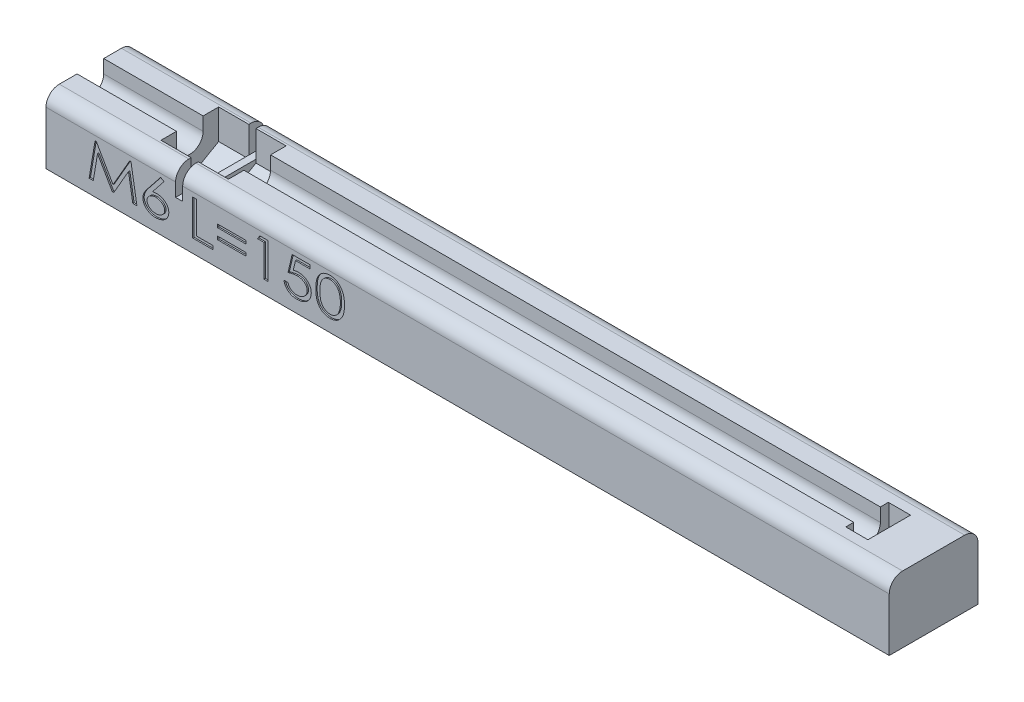
from build123d import *

# Parameters (mm, degrees)
SKETCH1_W                      = 180
SKETCH1_H                      = 20
BOSS_EXTRUDE1_DEPTH            = 15
CUT_EXTRUDE1_REACH             = 93.788
CUT_EXTRUDE1_DIRECTION_2_REACH = 93.788
BOSS_EXTRUDE2_DEPTH            = 10
CUT_EXTRUDE2_DEPTH             = 5
SKETCH8_W                      = 6.461538462
SKETCH8_H                      = 0.717948717
CUT_EXTRUDE3_DEPTH             = 0.3
CUT_EXTRUDE4_DEPTH             = 6.8
SKETCH10_W                     = 1.6
SKETCH10_H                     = 20
CUT_EXTRUDE5_DEPTH             = 6
FILLET1_R                      = 3


with BuildPart() as part:
    # Sketch1 → Boss-Extrude1 (new body)
    with BuildSketch(Plane(origin=(0, 0, 0), x_dir=(1, 0, 0), z_dir=(0, 1, 0))):
        Rectangle(SKETCH1_W, SKETCH1_H)
    extrude(amount=BOSS_EXTRUDE1_DEPTH)

    # Sketch2 → Cut-Extrude1 (cut, up to next)
    with BuildSketch(Plane(origin=(0, 0, 0), x_dir=(0, 0, -1), z_dir=(1, 0, 0)), mode=Mode.PRIVATE) as cut_extrude1_sk1:
        with BuildLine():
            Line((-3, 15), (-3, 12))
            ThreePointArc((-3, 12), (0, 9), (3, 12))
            Line((3, 12), (3, 15))
            Line((3, 15), (-3, 15))
        make_face()
    cut_extrude1_tool1 = extrude(cut_extrude1_sk1.sketch, amount=-CUT_EXTRUDE1_REACH, mode=Mode.PRIVATE) & part.part
    add(cut_extrude1_tool1.solids().sort_by_distance((0, 12.28005, 0))[0], mode=Mode.SUBTRACT)

    # Sketch2 → Cut-Extrude1 direction 2 (cut, up to next)
    with BuildSketch(Plane(origin=(0, 0, 0), x_dir=(0, 0, -1), z_dir=(1, 0, 0)), mode=Mode.PRIVATE) as cut_extrude1_direction_2_sk1:
        with BuildLine():
            Line((-3, 15), (-3, 12))
            ThreePointArc((-3, 12), (0, 9), (3, 12))
            Line((3, 12), (3, 15))
            Line((3, 15), (-3, 15))
        make_face()
    cut_extrude1_direction_2_tool1 = extrude(cut_extrude1_direction_2_sk1.sketch, amount=CUT_EXTRUDE1_DIRECTION_2_REACH, mode=Mode.PRIVATE) & part.part
    add(cut_extrude1_direction_2_tool1.solids().sort_by_distance((0, 12.28005, 0))[0], mode=Mode.SUBTRACT)

    # Sketch4 → Boss-Extrude2 (add)
    with BuildSketch(Plane(origin=(90, 0, 0), x_dir=(0, 0, -1), z_dir=(1, 0, 0))):
        Polygon((-3, 15), (3, 15), (10, 15), (10, 0), (-10, 0), (-10, 15), align=None)
    extrude(amount=BOSS_EXTRUDE2_DEPTH)

    # Sketch5 → Cut-Extrude2 (cut)
    with BuildSketch(Plane.ZY.offset(-90)):
        Polygon((0, 6.226497308), (5, 9.113248654), (5, 14.886751346), (0, 17.773502692), (-5, 14.886751346), (-5, 9.113248654), align=None)
    extrude(amount=CUT_EXTRUDE2_DEPTH, mode=Mode.SUBTRACT)

    # Sketch8 → Cut-Extrude3 (cut)
    # profile 1 of 8: a face of its own
    with BuildSketch(Plane.XY.offset(10)):
        Polygon((-80.282051282, 3), (-78.9375, 11), (-78.679487179, 11), (-74.897435897, 4.435897436), (-71.120192308, 11), (-70.858974359, 11), (-69.512820513, 3), (-70.443910256, 3), (-71.41025641, 8.743589744), (-74.71474359, 3), (-75.076923077, 3), (-78.384615385, 8.743589744), (-79.349358974, 3), align=None)
    # profile 2 of 8: a face of its own
    with BuildSketch(Plane.XY.offset(10)):
        with BuildLine():
            Line((-64.179487179, 11.205128205), (-63.411858974, 10.770833333))
            Line((-63.411858974, 10.770833333), (-65.996794872, 7.52724359))
            add(Edge.make_bspline(
                [(-65.996794872, 7.52724359), (-65.912495608, 7.540827068), (-65.747518127, 7.567410552), (-65.502521291, 7.59368184), (-65.265811478, 7.613319824), (-65.110082042, 7.614704869), (-65.033653846, 7.615384615)],
                knots=[0, 0, 0, 0, 1.058010251, 2.070574033, 3.053084957, 4, 4, 4, 4], degree=3))
            add(Edge.make_bspline(
                [(-65.033653846, 7.615384615), (-64.941142185, 7.613199815), (-64.759293256, 7.608905181), (-64.492341335, 7.57594411), (-64.23579274, 7.523560159), (-63.990526204, 7.448361123), (-63.756147485, 7.350603389), (-63.53113423, 7.234836131), (-63.318894141, 7.093224853), (-63.118233537, 6.934764045), (-62.935335607, 6.759779983), (-62.773686184, 6.573842937), (-62.638207487, 6.376807243), (-62.526454029, 6.170183519), (-62.439254094, 5.953081813), (-62.378871287, 5.725366823), (-62.340727108, 5.488460328), (-62.335821859, 5.327069117), (-62.333333333, 5.245192308)],
                knots=[0, 0, 0, 0, 1.109968203, 2.181849582, 3.222882052, 4.248963466, 5.254961958, 6.267151018, 7.280638538, 8.311873863, 9.332070617, 10.313900366, 11.263471539, 12.195680032, 13.127800347, 14.063968214, 15.01781452, 16, 16, 16, 16], degree=3))
            add(Edge.make_bspline(
                [(-62.333333333, 5.245192308), (-62.334634421, 5.188519095), (-62.337206059, 5.076502866), (-62.355622422, 4.910535031), (-62.383754533, 4.748534083), (-62.425547858, 4.59087795), (-62.4807846, 4.438029287), (-62.54674878, 4.288702959), (-62.623215906, 4.142306462), (-62.713399645, 4.002218594), (-62.812654438, 3.866578149), (-62.923925202, 3.738880816), (-63.043126834, 3.616489003), (-63.175109332, 3.504601305), (-63.313788371, 3.396042317), (-63.465362986, 3.297602588), (-63.625361925, 3.204141571), (-63.85234163, 3.09130817), (-64.149380301, 2.972902), (-64.521411744, 2.869005382), (-64.907111294, 2.807110703), (-65.169116617, 2.7989755), (-65.301282051, 2.794871795)],
                knots=[0, 0, 0, 0, 0.793694434, 1.568759805, 2.336385538, 3.095024302, 3.850001251, 4.610482715, 5.380293346, 6.160757427, 6.941938517, 7.732416952, 8.53134919, 9.332380938, 10.154010605, 10.996565294, 11.861546569, 12.748292787, 14.544837905, 16.331163668, 18.149299636, 20, 20, 20, 20], degree=3))
            add(Edge.make_bspline(
                [(-65.301282051, 2.794871795), (-65.429186955, 2.798336228), (-65.681605941, 2.805173252), (-66.053155279, 2.866565024), (-66.410324504, 2.966290001), (-66.695667858, 3.080419274), (-66.911828219, 3.191819881), (-67.065914215, 3.28337294), (-67.211822968, 3.381826097), (-67.347087535, 3.490452864), (-67.474010158, 3.60599811), (-67.592838812, 3.72923723), (-67.702114521, 3.861012843), (-67.801234806, 4.000590153), (-67.8902917, 4.145031058), (-67.967808684, 4.292695748), (-68.031664141, 4.443235271), (-68.087149488, 4.595168754), (-68.128647296, 4.750737452), (-68.157262773, 4.908892787), (-68.175473172, 5.069021774), (-68.178147073, 5.176768646), (-68.179487179, 5.230769231)],
                knots=[0, 0, 0, 0, 1.828951268, 3.609416145, 5.37106455, 7.126684359, 7.994917793, 8.848221521, 9.689807274, 10.511017729, 11.32794916, 12.14416524, 12.958339119, 13.774841414, 14.59148678, 15.384581438, 16.158327137, 16.929501742, 17.697031907, 18.458564307, 19.227463161, 20, 20, 20, 20], degree=3))
            add(Edge.make_bspline(
                [(-68.179487179, 5.230769231), (-68.176705795, 5.313228318), (-68.171013502, 5.481986509), (-68.123242199, 5.737022466), (-68.049075253, 5.998371198), (-67.962734452, 6.218615133), (-67.87554778, 6.39984197), (-67.799556311, 6.545603759), (-67.708253783, 6.696265827), (-67.607296752, 6.854972959), (-67.495814272, 7.021154707), (-67.371271231, 7.193364057), (-67.23552641, 7.372351301), (-67.139167047, 7.492739267), (-67.08974359, 7.554487179)],
                knots=[0, 0, 0, 0, 1.13348608, 2.31975718, 3.55715173, 4.86705391, 5.567099386, 6.323062346, 7.127029747, 7.989257616, 8.910398579, 9.879022036, 10.912134108, 12, 12, 12, 12], degree=3))
            Line((-67.08974359, 7.554487179), (-64.179487179, 11.205128205))
        make_face()
        with BuildLine():
            add(Edge.make_bspline(
                [(-65.253205128, 6.794871795), (-65.321085529, 6.793067507), (-65.454492267, 6.789521503), (-65.65092259, 6.769446701), (-65.839091848, 6.731250723), (-66.020988419, 6.682906493), (-66.194488387, 6.616431545), (-66.360533454, 6.535727659), (-66.519564326, 6.441274587), (-66.668620819, 6.332806559), (-66.806525491, 6.215525531), (-66.926462418, 6.088997544), (-67.029066489, 5.956991264), (-67.1113176, 5.81780367), (-67.1759844, 5.67263633), (-67.222743422, 5.521583525), (-67.250771838, 5.363749432), (-67.254507833, 5.256523887), (-67.256410256, 5.201923077)],
                knots=[0, 0, 0, 0, 1.148408277, 2.256990234, 3.334386658, 4.393132075, 5.43692792, 6.471453079, 7.512782197, 8.561065829, 9.586196649, 10.570453501, 11.504795903, 12.408218857, 13.298120773, 14.186967025, 15.076777194, 16, 16, 16, 16], degree=3))
            add(Edge.make_bspline(
                [(-67.256410256, 5.201923077), (-67.254569622, 5.147837068), (-67.250955381, 5.041634632), (-67.221981849, 4.885299639), (-67.178352863, 4.734533097), (-67.112604026, 4.590075834), (-67.029277973, 4.452738571), (-66.927708301, 4.321111979), (-66.809715921, 4.194236207), (-66.6717909, 4.077458608), (-66.52300085, 3.969489682), (-66.364709621, 3.873787454), (-66.198399933, 3.793687617), (-66.024016088, 3.730162352), (-65.843292628, 3.677855313), (-65.65455776, 3.641224821), (-65.457721652, 3.620639882), (-65.324298838, 3.617156858), (-65.256410256, 3.615384615)],
                knots=[0, 0, 0, 0, 0.916677999, 1.799974513, 2.688598419, 3.572638058, 4.483161525, 5.407330741, 6.388036378, 7.415942545, 8.467064206, 9.503440141, 10.548924041, 11.592364598, 12.647694815, 13.736899392, 14.848482625, 16, 16, 16, 16], degree=3))
            add(Edge.make_bspline(
                [(-65.256410256, 3.615384615), (-65.188524834, 3.617171967), (-65.055108228, 3.620684687), (-64.858749282, 3.641000239), (-64.670178714, 3.678345762), (-64.489275729, 3.729888733), (-64.314766886, 3.793321891), (-64.149404059, 3.874242193), (-63.991386269, 3.969427555), (-63.842671657, 4.077498144), (-63.704590181, 4.194143597), (-63.586891765, 4.321660593), (-63.483362823, 4.452188809), (-63.400306249, 4.590145254), (-63.334443767, 4.734514627), (-63.290844996, 4.885304536), (-63.261863483, 5.041633356), (-63.258250334, 5.147836638), (-63.256410256, 5.201923077)],
                knots=[0, 0, 0, 0, 1.151718944, 2.263496754, 3.34399913, 4.408229967, 5.451853174, 6.489360693, 7.52591804, 8.577223696, 9.605309794, 10.586187099, 11.516053716, 12.426736566, 13.310930953, 14.199710409, 15.083161541, 16, 16, 16, 16], degree=3))
            add(Edge.make_bspline(
                [(-63.256410256, 5.201923077), (-63.258269036, 5.256536183), (-63.261919324, 5.363785875), (-63.2905447, 5.521290976), (-63.334882218, 5.672863865), (-63.399676039, 5.818309237), (-63.484109044, 5.9560363), (-63.584515547, 6.089059783), (-63.703192268, 6.215955329), (-63.841007777, 6.332813434), (-63.989815083, 6.440772255), (-64.147738, 6.536182805), (-64.313557194, 6.616395333), (-64.486567434, 6.68260805), (-64.667781509, 6.731512764), (-64.855499359, 6.769402367), (-65.051914907, 6.789533189), (-65.185323688, 6.793071448), (-65.253205128, 6.794871795)],
                knots=[0, 0, 0, 0, 0.924732328, 1.815997387, 2.703671035, 3.595027991, 4.504577782, 5.434961697, 6.414618607, 7.441425573, 8.491423209, 9.526690886, 10.562907551, 11.608410062, 12.66016143, 13.739319459, 14.84971401, 16, 16, 16, 16], degree=3))
        make_face(mode=Mode.SUBTRACT)
    # profile 3 of 8: a face of its own
    with BuildSketch(Plane.XY.offset(10)):
        Polygon((-57, 11), (-56.076923077, 11), (-56.076923077, 3.820512821), (-52.384615385, 3.820512821), (-52.384615385, 3), (-57, 3), align=None)
    # profile 4 of 8: a face of its own
    with BuildSketch(Plane.XY.offset(10)):
        with Locations((-48.128205128, 8.17948718)):
            Rectangle(SKETCH8_W, SKETCH8_H)
    # profile 5 of 8: a face of its own
    with BuildSketch(Plane.XY.offset(10)):
        with Locations((-48.128205128, 5.820512821)):
            Rectangle(SKETCH8_W, SKETCH8_H)
    # profile 6 of 8: a face of its own
    with BuildSketch(Plane.XY.offset(10)):
        Polygon((-41.786858974, 11), (-39.974358974, 11), (-39.974358974, 3), (-40.897435897, 3), (-40.897435897, 10.179487179), (-42.333333333, 10.179487179), align=None)
    # profile 7 of 8: a face of its own
    with BuildSketch(Plane.XY.offset(10)):
        with BuildLine():
            Line((-30.538461538, 11), (-30.538461538, 10.179487179))
            Line((-30.538461538, 10.179487179), (-33.78525641, 10.179487179))
            Line((-33.78525641, 10.179487179), (-34.274038462, 8.065705128))
            add(Edge.make_bspline(
                [(-34.274038462, 8.065705128), (-34.174959039, 8.091031553), (-33.983262053, 8.140032638), (-33.699917774, 8.190258816), (-33.431983812, 8.225582666), (-33.257583508, 8.229076349), (-33.173076923, 8.230769231)],
                knots=[0, 0, 0, 0, 1.098923107, 2.126175579, 3.092028514, 4, 4, 4, 4], degree=3))
            add(Edge.make_bspline(
                [(-33.173076923, 8.230769231), (-33.068802129, 8.228842174), (-32.86390565, 8.225055571), (-32.563806018, 8.188540766), (-32.277396884, 8.131515128), (-32.00543736, 8.051117826), (-31.747248387, 7.948831795), (-31.504306999, 7.820731077), (-31.273673146, 7.671813883), (-31.060473667, 7.498802633), (-30.865958024, 7.310172471), (-30.695381701, 7.106576697), (-30.552795205, 6.889405352), (-30.434067586, 6.659885734), (-30.342888265, 6.416606129), (-30.276834606, 6.160487301), (-30.237882912, 5.891157499), (-30.23317, 5.707392437), (-30.230769231, 5.613782051)],
                knots=[0, 0, 0, 0, 1.134454317, 2.229164743, 3.28500468, 4.309666315, 5.311560225, 6.302360275, 7.294115116, 8.294726146, 9.285577369, 10.239157013, 11.179259903, 12.107548962, 13.045924382, 14.000584569, 14.981492743, 16, 16, 16, 16], degree=3))
            add(Edge.make_bspline(
                [(-30.230769231, 5.613782051), (-30.231851162, 5.548552643), (-30.234002939, 5.418822422), (-30.255853986, 5.226604134), (-30.289558543, 5.038179553), (-30.335486332, 4.853567513), (-30.396965751, 4.673852264), (-30.471197006, 4.49837334), (-30.557841532, 4.326150371), (-30.658154413, 4.159112177), (-30.770451527, 3.999745504), (-30.890494427, 3.84749389), (-31.022543726, 3.707394962), (-31.16216059, 3.574361022), (-31.313190345, 3.453582062), (-31.472465218, 3.340008915), (-31.642353037, 3.238297779), (-31.820590866, 3.145346835), (-32.006154058, 3.061136017), (-32.201256871, 2.991509849), (-32.402244436, 2.93055985), (-32.610846612, 2.88035979), (-32.826054795, 2.842371252), (-33.048646005, 2.815716306), (-33.277980505, 2.796627668), (-33.43371975, 2.795463223), (-33.512820513, 2.794871795)],
                knots=[0, 0, 0, 0, 0.969983009, 1.929131535, 2.873718773, 3.81616439, 4.755993309, 5.696124526, 6.648534221, 7.621572097, 8.591555105, 9.547141935, 10.502960018, 11.452979889, 12.413542823, 13.377026655, 14.360970691, 15.356177306, 16.366340802, 17.389454646, 18.435245734, 19.489516103, 20.579101985, 21.683995992, 22.823689667, 24, 24, 24, 24], degree=3))
            add(Edge.make_bspline(
                [(-33.512820513, 2.794871795), (-33.606404267, 2.796447281), (-33.790348059, 2.799543981), (-34.060094372, 2.831989653), (-34.319416401, 2.878424987), (-34.566874305, 2.948205714), (-34.804275964, 3.036243197), (-35.02955175, 3.145623673), (-35.24491282, 3.272488065), (-35.445645371, 3.420235103), (-35.632371149, 3.58199937), (-35.79970908, 3.757923065), (-35.948827293, 3.944086592), (-36.074739251, 4.14385657), (-36.183736651, 4.353593896), (-36.271146634, 4.57558467), (-36.34177411, 4.80851985), (-36.370220658, 4.969713624), (-36.384615385, 5.051282051)],
                knots=[0, 0, 0, 0, 1.123367549, 2.208038014, 3.258707693, 4.284481523, 5.291404347, 6.295687251, 7.288117666, 8.289013781, 9.284818446, 10.25134312, 11.201179919, 12.144429081, 13.082690711, 14.035750275, 15.006036297, 16, 16, 16, 16], degree=3))
            Line((-36.384615385, 5.051282051), (-35.461538462, 5.051282051))
            add(Edge.make_bspline(
                [(-35.461538462, 5.051282051), (-35.441304775, 4.974906077), (-35.402284032, 4.827614715), (-35.318119136, 4.621004556), (-35.213697738, 4.437591203), (-35.090408308, 4.274196286), (-34.944728592, 4.130689398), (-34.776543085, 4.005531303), (-34.589653711, 3.889348211), (-34.38087329, 3.79483882), (-34.160291996, 3.71340594), (-33.930345231, 3.659240293), (-33.696247729, 3.621042302), (-33.538084544, 3.617281127), (-33.458333333, 3.615384615)],
                knots=[0, 0, 0, 0, 1.062738926, 2.049496155, 2.99307837, 3.896205757, 4.796150332, 5.735228812, 6.713144046, 7.752194435, 8.814349412, 9.87292067, 10.92745488, 12, 12, 12, 12], degree=3))
            add(Edge.make_bspline(
                [(-33.458333333, 3.615384615), (-33.380788243, 3.617272304), (-33.227886555, 3.620994408), (-33.002832151, 3.64927985), (-32.785703358, 3.692876404), (-32.578425451, 3.758720237), (-32.377501894, 3.837580517), (-32.187540795, 3.94044454), (-32.003237118, 4.056683438), (-31.832013041, 4.192734337), (-31.673968369, 4.340742933), (-31.532967348, 4.498422618), (-31.418025356, 4.669063788), (-31.319582585, 4.845511813), (-31.247116965, 5.033201728), (-31.190565404, 5.227936664), (-31.161045095, 5.433398243), (-31.156274799, 5.573104001), (-31.153846154, 5.644230769)],
                knots=[0, 0, 0, 0, 1.088829166, 2.146929194, 3.181356287, 4.194671525, 5.197797381, 6.208024805, 7.223670527, 8.254827386, 9.273931223, 10.262757869, 11.217966775, 12.158058171, 13.094309505, 14.037300533, 15.000753635, 16, 16, 16, 16], degree=3))
            add(Edge.make_bspline(
                [(-31.153846154, 5.644230769), (-31.155608252, 5.708446994), (-31.159062967, 5.83434735), (-31.188719931, 6.01822142), (-31.236602078, 6.192573386), (-31.304695834, 6.357665418), (-31.391772842, 6.513267023), (-31.49650029, 6.661019266), (-31.622788618, 6.797309888), (-31.767192307, 6.923411815), (-31.926333609, 7.038028447), (-32.099270562, 7.138930111), (-32.286646766, 7.220878506), (-32.485102672, 7.293000458), (-32.69768858, 7.344170127), (-32.921851562, 7.383465773), (-33.159285966, 7.405418923), (-33.322073357, 7.408617953), (-33.405448718, 7.41025641)],
                knots=[0, 0, 0, 0, 0.959581286, 1.881325554, 2.776530137, 3.65751396, 4.544163099, 5.437298997, 6.358662586, 7.315081268, 8.299208911, 9.286862571, 10.302126627, 11.352955398, 12.439623036, 13.566177345, 14.753460948, 16, 16, 16, 16], degree=3))
            add(Edge.make_bspline(
                [(-33.405448718, 7.41025641), (-33.478137178, 7.408953064), (-33.627490898, 7.406275066), (-33.856931104, 7.385878224), (-34.097537612, 7.353749703), (-34.349296263, 7.30844776), (-34.611795282, 7.250793813), (-34.885223929, 7.179361612), (-35.17024333, 7.096514599), (-35.362910873, 7.032678206), (-35.461538462, 7)],
                knots=[0, 0, 0, 0, 0.828490731, 1.702308341, 2.623773087, 3.594863751, 4.617271015, 5.686547465, 6.815730754, 8, 8, 8, 8], degree=3))
            Line((-35.461538462, 7), (-34.538461538, 11))
            Line((-34.538461538, 11), (-30.538461538, 11))
        make_face()
    # profile 8 of 8: a face of its own
    with BuildSketch(Plane.XY.offset(10)):
        with BuildLine():
            add(Edge.make_bspline(
                [(-29.205128205, 6.996794872), (-29.204040362, 7.125032019), (-29.201926833, 7.374179129), (-29.181519492, 7.737043877), (-29.15319279, 8.077942489), (-29.107335019, 8.395907618), (-29.052416938, 8.691516012), (-28.98371319, 8.964605331), (-28.902599037, 9.215545651), (-28.807228109, 9.44497791), (-28.700026463, 9.656085774), (-28.585523542, 9.854153325), (-28.45749571, 10.037681568), (-28.32056748, 10.209144418), (-28.172067295, 10.366544944), (-28.015232421, 10.512124573), (-27.845393033, 10.641341739), (-27.668472853, 10.760501145), (-27.481808652, 10.864085633), (-27.289905106, 10.955726055), (-27.092264529, 11.032897367), (-26.889108749, 11.095324747), (-26.681000502, 11.145344701), (-26.467302735, 11.18029996), (-26.248315294, 11.201925593), (-26.100477987, 11.204051863), (-26.025641026, 11.205128205)],
                knots=[0, 0, 0, 0, 1.542683654, 2.997221792, 4.371598944, 5.656797318, 6.860561199, 7.987553175, 9.042377021, 10.030645594, 10.973394823, 11.889388256, 12.780791065, 13.663064894, 14.526958713, 15.382106205, 16.234399085, 17.091789701, 17.946381534, 18.800199673, 19.648776936, 20.49647757, 21.355408439, 22.221808829, 23.099858982, 24, 24, 24, 24], degree=3))
            add(Edge.make_bspline(
                [(-26.025641026, 11.205128205), (-25.949736393, 11.204051384), (-25.799768079, 11.201923858), (-25.577583675, 11.180297788), (-25.360686877, 11.145349459), (-25.149386139, 11.095315897), (-24.943007354, 11.032945055), (-24.742261649, 10.955616928), (-24.546560657, 10.864490029), (-24.357836769, 10.758432782), (-24.175315732, 10.639839535), (-24.00303033, 10.505443872), (-23.840729645, 10.357053574), (-23.686999039, 10.196222565), (-23.545309465, 10.01944407), (-23.411488226, 9.829757832), (-23.288214191, 9.625530826), (-23.174012764, 9.40698213), (-23.070402491, 9.172086281), (-22.98268381, 8.91790429), (-22.90955111, 8.64456707), (-22.849062263, 8.352374713), (-22.800628266, 8.040619786), (-22.768444022, 7.709403577), (-22.746517671, 7.359270119), (-22.744582475, 7.119694237), (-22.743589744, 6.996794872)],
                knots=[0, 0, 0, 0, 0.905226779, 1.788498657, 2.660108446, 3.524138063, 4.376813936, 5.230061085, 6.088148717, 6.949707488, 7.810441066, 8.682307051, 9.552891307, 10.431831136, 11.333484681, 12.252799274, 13.19921049, 14.17683564, 15.192654415, 16.258736151, 17.380986388, 18.565756088, 19.816677794, 21.14251623, 22.534147352, 24, 24, 24, 24], degree=3))
            add(Edge.make_bspline(
                [(-22.743589744, 6.996794872), (-22.744593265, 6.874430905), (-22.746549282, 6.635924888), (-22.768319612, 6.287373526), (-22.801037581, 5.957904186), (-22.847566628, 5.647704116), (-22.905785905, 5.356767374), (-22.980293561, 5.0851961), (-23.065116729, 4.831537216), (-23.167670421, 4.597873914), (-23.280199904, 4.380905615), (-23.402195251, 4.177600104), (-23.535623793, 3.988489618), (-23.677994683, 3.811846391), (-23.83056974, 3.648796172), (-23.995006991, 3.501507931), (-24.167954114, 3.366281031), (-24.350908731, 3.245986412), (-24.541945854, 3.141254895), (-24.73732496, 3.046621285), (-24.940216365, 2.970896244), (-25.146985139, 2.906019688), (-25.35911215, 2.856241064), (-25.576596785, 2.821694182), (-25.799139507, 2.79760738), (-25.949721333, 2.795788719), (-26.025641026, 2.794871795)],
                knots=[0, 0, 0, 0, 1.46072825, 2.847181955, 4.167808125, 5.412532487, 6.590778144, 7.707832089, 8.77274499, 9.781035283, 10.750894225, 11.68935627, 12.609456302, 13.511880197, 14.396205746, 15.272259263, 16.144870147, 17.015170588, 17.883037273, 18.744577062, 19.604510117, 20.465884645, 21.330652466, 22.203006937, 23.093999819, 24, 24, 24, 24], degree=3))
            add(Edge.make_bspline(
                [(-26.025641026, 2.794871795), (-26.100476904, 2.795954073), (-26.248312071, 2.798092069), (-26.467315188, 2.819631789), (-26.680320355, 2.854802014), (-26.887878033, 2.90340072), (-27.090575188, 2.963123532), (-27.286284357, 3.041522522), (-27.477044626, 3.130940879), (-27.662002859, 3.233145963), (-27.838097135, 3.350933815), (-28.007014922, 3.480060816), (-28.164771623, 3.624824647), (-28.309679349, 3.784970176), (-28.449160635, 3.95438779), (-28.575538588, 4.140057874), (-28.692148806, 4.338981515), (-28.800814071, 4.551805187), (-28.897683448, 4.78283054), (-28.981049695, 5.035087933), (-29.048349266, 5.309844878), (-29.106370191, 5.604934923), (-29.150891066, 5.922185567), (-29.182189737, 6.261235348), (-29.201715238, 6.622099518), (-29.203969927, 6.869632423), (-29.205128205, 6.996794872)],
                knots=[0, 0, 0, 0, 0.901313614, 1.780507586, 2.648036619, 3.500347198, 4.347271604, 5.190962528, 6.037324413, 6.884273269, 7.733858471, 8.587261616, 9.443523092, 10.308877354, 11.187293768, 12.085154678, 13.011148997, 13.963773228, 14.961747202, 16.026069565, 17.160769593, 18.367320705, 19.647821669, 21.018168876, 22.468175576, 24, 24, 24, 24], degree=3))
        make_face()
        with BuildLine():
            add(Edge.make_bspline(
                [(-28.282051282, 7), (-28.281020722, 6.893152289), (-28.279020667, 6.685788144), (-28.26670799, 6.384277715), (-28.244153581, 6.1031703), (-28.214612181, 5.842061607), (-28.174160783, 5.601551286), (-28.12737348, 5.380154039), (-28.069628308, 5.179483843), (-28.00360379, 4.997214159), (-27.927416206, 4.831151444), (-27.843589025, 4.676640081), (-27.75298014, 4.531489318), (-27.65090862, 4.398968799), (-27.543498242, 4.274136045), (-27.426506838, 4.159899896), (-27.299268535, 4.058046414), (-27.123160906, 3.934476566), (-26.891098732, 3.807357396), (-26.60026371, 3.697705565), (-26.301315523, 3.628323774), (-26.09865865, 3.619712833), (-25.996794872, 3.615384615)],
                knots=[0, 0, 0, 0, 1.38831948, 2.694373882, 3.919816282, 5.051935599, 6.107419077, 7.087623599, 7.990490188, 8.818311697, 9.604127399, 10.361917097, 11.101333988, 11.824579067, 12.533018531, 13.239824075, 13.945504104, 14.648311054, 16.033712652, 17.369238315, 18.677669692, 20, 20, 20, 20], degree=3))
            add(Edge.make_bspline(
                [(-25.996794872, 3.615384615), (-25.894363555, 3.618951829), (-25.691068246, 3.626031673), (-25.393311056, 3.696498269), (-25.104342366, 3.801708667), (-24.876256547, 3.927672475), (-24.702593705, 4.04740718), (-24.579270213, 4.149829267), (-24.464403327, 4.262866796), (-24.358770357, 4.387847765), (-24.257702895, 4.520545206), (-24.169434341, 4.667207537), (-24.086413988, 4.82298006), (-24.039775857, 4.932837661), (-24.016025641, 4.988782051)],
                knots=[0, 0, 0, 0, 1.435202654, 2.84844493, 4.271653763, 5.741104123, 6.489771913, 7.229832304, 7.987899838, 8.748188279, 9.524858768, 10.325895147, 11.147471145, 12, 12, 12, 12], degree=3))
            add(Edge.make_bspline(
                [(-24.016025641, 4.988782051), (-23.987858382, 5.060032124), (-23.930860952, 5.204209132), (-23.861319537, 5.430034079), (-23.80025896, 5.665179592), (-23.750065747, 5.911124), (-23.714290442, 6.168182004), (-23.687322728, 6.43599841), (-23.668458405, 6.714475919), (-23.667270258, 6.903814134), (-23.666666667, 7)],
                knots=[0, 0, 0, 0, 0.894744113, 1.810545934, 2.758053543, 3.73225045, 4.740993082, 5.788541401, 6.876555049, 8, 8, 8, 8], degree=3))
            add(Edge.make_bspline(
                [(-23.666666667, 7), (-23.667556193, 7.096171456), (-23.669296755, 7.284353022), (-23.683842189, 7.559682753), (-23.7078372, 7.821628005), (-23.74051993, 8.070560828), (-23.786247552, 8.305520435), (-23.837811288, 8.528155303), (-23.902924453, 8.736263989), (-23.974149015, 8.932704125), (-24.056137085, 9.114755596), (-24.144661363, 9.284587853), (-24.240514312, 9.441842296), (-24.344764456, 9.586718504), (-24.457247923, 9.718121381), (-24.576079065, 9.837841235), (-24.702990684, 9.943645369), (-24.879569122, 10.066663049), (-25.110884602, 10.191360222), (-25.397868961, 10.305254428), (-25.695244925, 10.370845314), (-25.896064499, 10.380015602), (-25.996794872, 10.384615385)],
                knots=[0, 0, 0, 0, 1.249760288, 2.445443362, 3.581794841, 4.66765873, 5.706502035, 6.691529073, 7.635763366, 8.538482956, 9.405473661, 10.228345248, 11.026058236, 11.796761803, 12.545227164, 13.271735534, 13.986372328, 14.689314151, 16.065558997, 17.390854983, 18.691262289, 20, 20, 20, 20], degree=3))
            add(Edge.make_bspline(
                [(-25.996794872, 10.384615385), (-26.099135004, 10.380062736), (-26.302619614, 10.371010629), (-26.603575541, 10.305105009), (-26.892887512, 10.192617013), (-27.123294031, 10.066573346), (-27.298113925, 9.945217771), (-27.423458272, 9.843344672), (-27.538553151, 9.727965033), (-27.64801006, 9.60537011), (-27.747979098, 9.471127531), (-27.838579585, 9.326200566), (-27.924655417, 9.172557113), (-27.999859238, 9.005575839), (-28.068609764, 8.824134903), (-28.125299504, 8.623456199), (-28.173141747, 8.40230417), (-28.212407931, 8.160990372), (-28.244601257, 7.899626333), (-28.266667933, 7.617845721), (-28.279041902, 7.315818071), (-28.281028044, 7.107383285), (-28.282051282, 7)],
                knots=[0, 0, 0, 0, 1.329248884, 2.642967946, 3.980958656, 5.350847825, 6.043989978, 6.744288631, 7.446133388, 8.159146261, 8.878214269, 9.617629172, 10.378747087, 11.164560677, 11.994791529, 12.897655691, 13.871076311, 14.933403927, 16.073238494, 17.291758783, 18.60474423, 20, 20, 20, 20], degree=3))
        make_face(mode=Mode.SUBTRACT)
    extrude(amount=-CUT_EXTRUDE3_DEPTH, mode=Mode.SUBTRACT)

    # Sketch9 → Cut-Extrude4 (cut)
    with BuildSketch(Plane.ZY.offset(60.8)):
        Polygon((0, 4.494446501), (6.5, 8.24722325), (6.5, 15.75277675), (0, 19.505553499), (-6.5, 15.75277675), (-6.5, 8.24722325), align=None)
    cut_extrude4 = extrude(amount=CUT_EXTRUDE4_DEPTH, mode=Mode.SUBTRACT)

    # Mirror1: Cut-Extrude4 across plane
    add(cut_extrude4.mirror(Plane.ZY.offset(60)), mode=Mode.SUBTRACT)

    # Sketch10 → Cut-Extrude5 (cut)
    with BuildSketch(Plane(origin=(0, 15, 0), x_dir=(1, 0, 0), z_dir=(0, 1, 0))):
        with Locations((-60, 0)):
            Rectangle(SKETCH10_W, SKETCH10_H)
    extrude(amount=-CUT_EXTRUDE5_DEPTH, mode=Mode.SUBTRACT)

    # Fillet1
    fillet1_edges = [part.edges().sort_by_distance(p)[0] for p in [
        (20.4, 15, -10),
        (-75.4, 15, -10),
        (20.4, 15, 10),
        (-75.4, 15, 10),
    ]]
    fillet(fillet1_edges, radius=FILLET1_R)


solid = part.part
